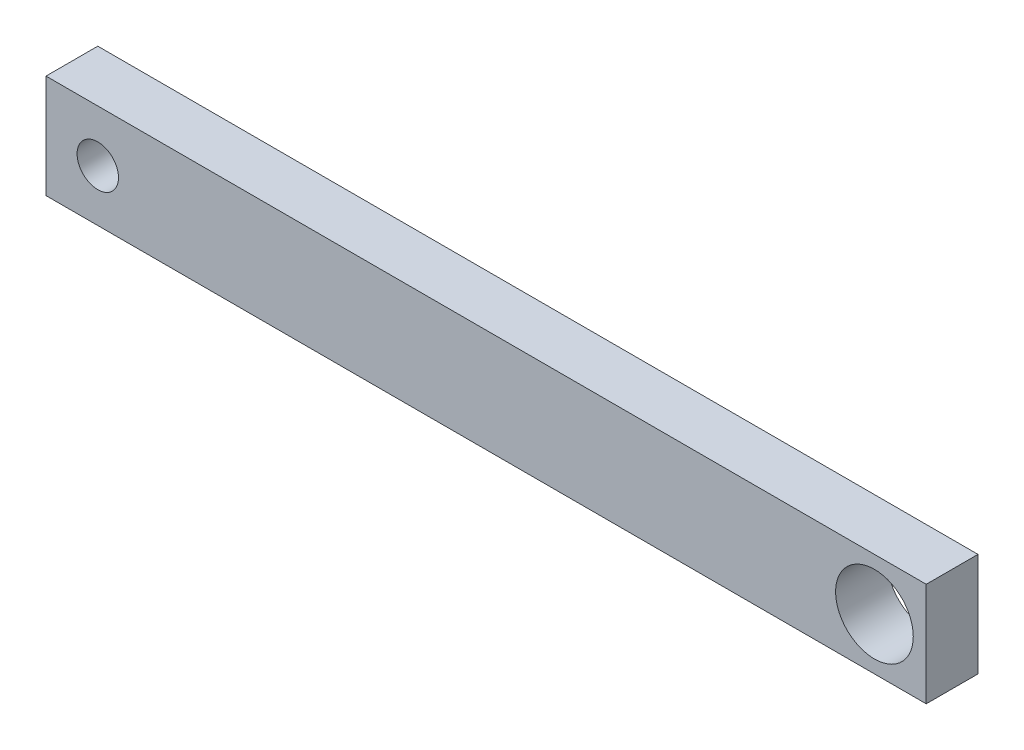
from build123d import *

# Parameters (mm, degrees)
SKETCH_1_W      = 170
SKETCH_1_H      = 20
SKETCH_1_R      = 4
SKETCH_1_R_2    = 7.5
EXTRUDE_1_DEPTH = 10


with BuildPart() as part:
    # 草图1 → 凸台-拉伸1 (new body)
    with BuildSketch(Plane.XY):
        with Locations((85, -10)):
            Rectangle(SKETCH_1_W, SKETCH_1_H)
        with Locations((10, -10)):
            Circle(SKETCH_1_R, mode=Mode.SUBTRACT)
        with Locations((160, -10)):
            Circle(SKETCH_1_R_2, mode=Mode.SUBTRACT)
    extrude(amount=EXTRUDE_1_DEPTH)


solid = part.part
